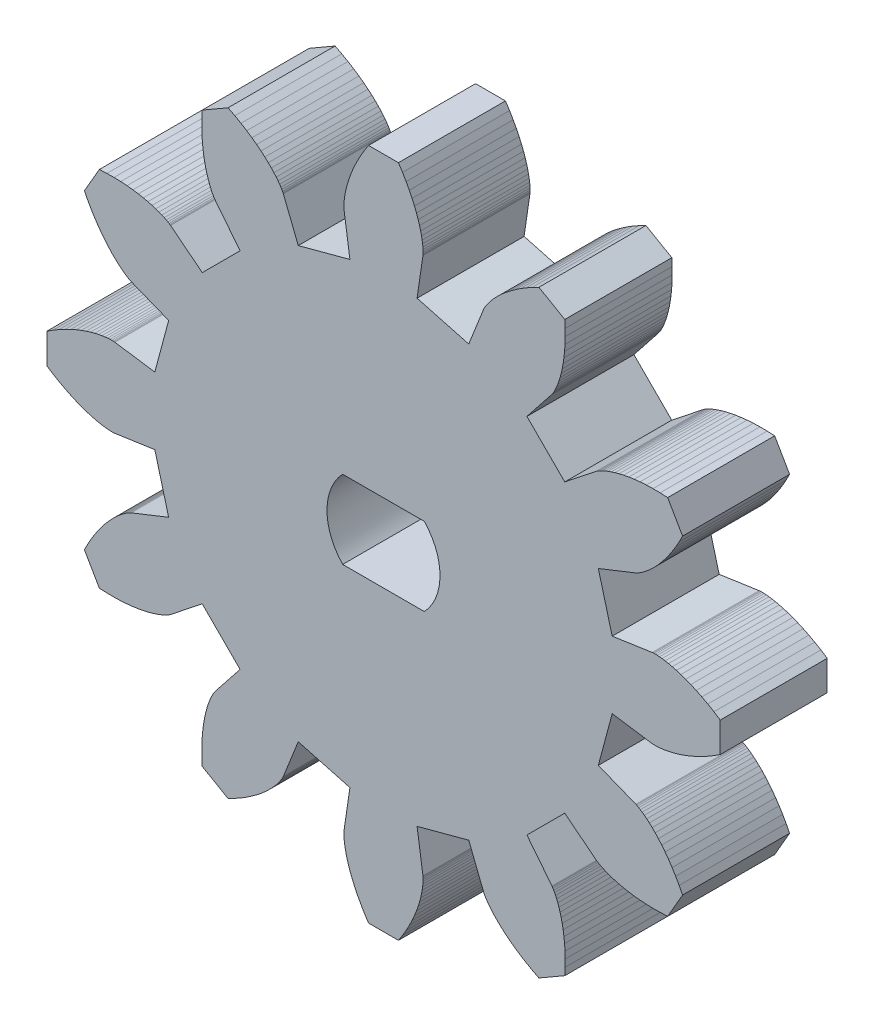
from build123d import *

# Parameters (mm, degrees)
BOSS_EXTRUDE1_DEPTH = 5
CUT_EXTRUDE1_DEPTH  = 5


with BuildPart() as part:
    # Model → Boss-Extrude1 (new body)
    with BuildSketch(Plane.XY):
        Polygon((10.685405612, 1.569110225), (12.551246005, 1.843101624), (12.5606903, 1.844240275), (12.589123441, 1.846679017), (12.636631842, 1.848946657), (12.703216397, 1.849568363), (12.788792368, 1.847070079), (12.893189492, 1.839982951), (13.016152296, 1.826847731), (13.157340631, 1.806219174), (13.316330413, 1.776670401), (13.492614581, 1.736797226), (13.685604259, 1.685222429), (13.894630123, 1.620599984), (14.118943977, 1.541619205), (14.357720528, 1.447008826), (14.610059353, 1.335540993), (14.874987068, 1.206035154), (15.151459674, 1.057361855), (15.438365097, 0.888446416), (15.734525898, 0.698272491), (15.734525898, -0.698272491), (15.438365097, -0.888446416), (15.151459674, -1.057361855), (14.874987068, -1.206035154), (14.610059353, -1.335540993), (14.357720528, -1.447008826), (14.118943977, -1.541619205), (13.894630123, -1.620599984), (13.685604259, -1.685222429), (13.492614581, -1.736797226), (13.316330413, -1.776670401), (13.157340631, -1.806219174), (13.016152296, -1.826847731), (12.893189492, -1.839982951), (12.788792368, -1.847070079), (12.703216397, -1.849568363), (12.636631842, -1.848946657), (12.589123441, -1.846679017), (12.5606903, -1.844240275), (12.551246005, -1.843101624), (10.685405612, -1.569110225), (10.038387822, -3.98381349), (11.791248702, -4.679450174), (11.799997027, -4.683186221), (11.82584022, -4.695290779), (11.868117522, -4.717081145), (11.926092291, -4.74983501), (11.998954114, -4.794786573), (12.085821112, -4.853122768), (12.185742414, -4.925979605), (12.297700819, -5.014438626), (12.420615624, -5.119523505), (12.553345604, -5.242196772), (12.694692169, -5.383356695), (12.843402654, -5.543834306), (12.998173761, -5.724390594), (13.157655131, -5.925713861), (13.320453048, -6.148417249), (13.485134259, -6.393036453), (13.65022991, -6.66002761), (13.814239575, -6.949765382), (13.975635389, -7.262541233), (13.277362898, -8.471984665), (12.925793159, -8.488599714), (12.592868055, -8.491432064), (12.279099105, -8.481950616), (11.984912054, -8.461642105), (11.710646304, -8.432006667), (11.456554556, -8.394553383), (11.222802671, -8.350795816), (11.00946974, -8.302247564), (10.816548378, -8.250417809), (10.643945222, -8.196806908), (10.491481646, -8.142902005), (10.358894683, -8.090172692), (10.245838161, -8.040066724), (10.151884035, -7.994005795), (10.076523928, -7.953381387), (10.019170864, -7.919550696), (9.979161202, -7.893832662), (9.955756751, -7.877504079), (9.948147078, -7.871795831), (8.469277598, -6.701592122), (6.701592122, -8.469277598), (7.871795831, -9.948147078), (7.877504079, -9.955756751), (7.893832662, -9.979161202), (7.919550696, -10.019170864), (7.953381387, -10.076523928), (7.994005795, -10.151884035), (8.040066724, -10.245838161), (8.090172692, -10.358894683), (8.142902005, -10.491481646), (8.196806908, -10.643945222), (8.250417809, -10.816548378), (8.302247564, -11.00946974), (8.350795816, -11.222802671), (8.394553383, -11.456554556), (8.432006667, -11.710646304), (8.461642105, -11.984912054), (8.481950616, -12.279099105), (8.491432064, -12.592868055), (8.488599714, -12.925793159), (8.471984665, -13.277362898), (7.262541233, -13.975635389), (6.949765382, -13.814239575), (6.66002761, -13.65022991), (6.393036453, -13.485134259), (6.148417249, -13.320453048), (5.925713861, -13.157655131), (5.724390594, -12.998173761), (5.543834306, -12.843402654), (5.383356695, -12.694692169), (5.242196772, -12.553345604), (5.119523505, -12.420615624), (5.014438626, -12.297700819), (4.925979605, -12.185742414), (4.853122768, -12.085821112), (4.794786573, -11.998954114), (4.74983501, -11.926092291), (4.717081145, -11.868117522), (4.695290779, -11.82584022), (4.683186221, -11.799997027), (4.679450174, -11.791248702), (3.98381349, -10.038387822), (1.569110225, -10.685405612), (1.843101624, -12.551246005), (1.844240275, -12.5606903), (1.846679017, -12.589123441), (1.848946657, -12.636631842), (1.849568363, -12.703216397), (1.847070079, -12.788792368), (1.839982951, -12.893189492), (1.826847731, -13.016152296), (1.806219174, -13.157340631), (1.776670401, -13.316330413), (1.736797226, -13.492614581), (1.685222429, -13.685604259), (1.620599984, -13.894630123), (1.541619205, -14.118943977), (1.447008826, -14.357720528), (1.335540993, -14.610059353), (1.206035154, -14.874987068), (1.057361855, -15.151459674), (0.888446416, -15.438365097), (0.698272491, -15.734525898), (-0.698272491, -15.734525898), (-0.888446416, -15.438365097), (-1.057361855, -15.151459674), (-1.206035154, -14.874987068), (-1.335540993, -14.610059353), (-1.447008826, -14.357720528), (-1.541619205, -14.118943977), (-1.620599984, -13.894630123), (-1.685222429, -13.685604259), (-1.736797226, -13.492614581), (-1.776670401, -13.316330413), (-1.806219174, -13.157340631), (-1.826847731, -13.016152296), (-1.839982951, -12.893189492), (-1.847070079, -12.788792368), (-1.849568363, -12.703216397), (-1.848946657, -12.636631842), (-1.846679017, -12.589123441), (-1.844240275, -12.5606903), (-1.843101624, -12.551246005), (-1.569110225, -10.685405612), (-3.98381349, -10.038387822), (-4.679450174, -11.791248702), (-4.683186221, -11.799997027), (-4.695290779, -11.82584022), (-4.717081145, -11.868117522), (-4.74983501, -11.926092291), (-4.794786573, -11.998954114), (-4.853122768, -12.085821112), (-4.925979605, -12.185742414), (-5.014438626, -12.297700819), (-5.119523505, -12.420615624), (-5.242196772, -12.553345604), (-5.383356695, -12.694692169), (-5.543834306, -12.843402654), (-5.724390594, -12.998173761), (-5.925713861, -13.157655131), (-6.148417249, -13.320453048), (-6.393036453, -13.485134259), (-6.66002761, -13.65022991), (-6.949765382, -13.814239575), (-7.262541233, -13.975635389), (-8.471984665, -13.277362898), (-8.488599714, -12.925793159), (-8.491432064, -12.592868055), (-8.481950616, -12.279099105), (-8.461642105, -11.984912054), (-8.432006667, -11.710646304), (-8.394553383, -11.456554556), (-8.350795816, -11.222802671), (-8.302247564, -11.00946974), (-8.250417809, -10.816548378), (-8.196806908, -10.643945222), (-8.142902005, -10.491481646), (-8.090172692, -10.358894683), (-8.040066724, -10.245838161), (-7.994005795, -10.151884035), (-7.953381387, -10.076523928), (-7.919550696, -10.019170864), (-7.893832662, -9.979161202), (-7.877504079, -9.955756751), (-7.871795831, -9.948147078), (-6.701592122, -8.469277598), (-8.469277598, -6.701592122), (-9.948147078, -7.871795831), (-9.955756751, -7.877504079), (-9.979161202, -7.893832662), (-10.019170864, -7.919550696), (-10.076523928, -7.953381387), (-10.151884035, -7.994005795), (-10.245838161, -8.040066724), (-10.358894683, -8.090172692), (-10.491481646, -8.142902005), (-10.643945222, -8.196806908), (-10.816548378, -8.250417809), (-11.00946974, -8.302247564), (-11.222802671, -8.350795816), (-11.456554556, -8.394553383), (-11.710646304, -8.432006667), (-11.984912054, -8.461642105), (-12.279099105, -8.481950616), (-12.592868055, -8.491432064), (-12.925793159, -8.488599714), (-13.277362898, -8.471984665), (-13.975635389, -7.262541233), (-13.814239575, -6.949765382), (-13.65022991, -6.66002761), (-13.485134259, -6.393036453), (-13.320453048, -6.148417249), (-13.157655131, -5.925713861), (-12.998173761, -5.724390594), (-12.843402654, -5.543834306), (-12.694692169, -5.383356695), (-12.553345604, -5.242196772), (-12.420615624, -5.119523505), (-12.297700819, -5.014438626), (-12.185742414, -4.925979605), (-12.085821112, -4.853122768), (-11.998954114, -4.794786573), (-11.926092291, -4.74983501), (-11.868117522, -4.717081145), (-11.82584022, -4.695290779), (-11.799997027, -4.683186221), (-11.791248702, -4.679450174), (-10.038387822, -3.98381349), (-10.685405612, -1.569110225), (-12.551246005, -1.843101624), (-12.5606903, -1.844240275), (-12.589123441, -1.846679017), (-12.636631842, -1.848946657), (-12.703216397, -1.849568363), (-12.788792368, -1.847070079), (-12.893189492, -1.839982951), (-13.016152296, -1.826847731), (-13.157340631, -1.806219174), (-13.316330413, -1.776670401), (-13.492614581, -1.736797226), (-13.685604259, -1.685222429), (-13.894630123, -1.620599984), (-14.118943977, -1.541619205), (-14.357720528, -1.447008826), (-14.610059353, -1.335540993), (-14.874987068, -1.206035154), (-15.151459674, -1.057361855), (-15.438365097, -0.888446416), (-15.734525898, -0.698272491), (-15.734525898, 0.698272491), (-15.438365097, 0.888446416), (-15.151459674, 1.057361855), (-14.874987068, 1.206035154), (-14.610059353, 1.335540993), (-14.357720528, 1.447008826), (-14.118943977, 1.541619205), (-13.894630123, 1.620599984), (-13.685604259, 1.685222429), (-13.492614581, 1.736797226), (-13.316330413, 1.776670401), (-13.157340631, 1.806219174), (-13.016152296, 1.826847731), (-12.893189492, 1.839982951), (-12.788792368, 1.847070079), (-12.703216397, 1.849568363), (-12.636631842, 1.848946657), (-12.589123441, 1.846679017), (-12.5606903, 1.844240275), (-12.551246005, 1.843101624), (-10.685405612, 1.569110225), (-10.038387822, 3.98381349), (-11.791248702, 4.679450174), (-11.799997027, 4.683186221), (-11.82584022, 4.695290779), (-11.868117522, 4.717081145), (-11.926092291, 4.74983501), (-11.998954114, 4.794786573), (-12.085821112, 4.853122768), (-12.185742414, 4.925979605), (-12.297700819, 5.014438626), (-12.420615624, 5.119523505), (-12.553345604, 5.242196772), (-12.694692169, 5.383356695), (-12.843402654, 5.543834306), (-12.998173761, 5.724390594), (-13.157655131, 5.925713861), (-13.320453048, 6.148417249), (-13.485134259, 6.393036453), (-13.65022991, 6.66002761), (-13.814239575, 6.949765382), (-13.975635389, 7.262541233), (-13.277362898, 8.471984665), (-12.925793159, 8.488599714), (-12.592868055, 8.491432064), (-12.279099105, 8.481950616), (-11.984912054, 8.461642105), (-11.710646304, 8.432006667), (-11.456554556, 8.394553383), (-11.222802671, 8.350795816), (-11.00946974, 8.302247564), (-10.816548378, 8.250417809), (-10.643945222, 8.196806908), (-10.491481646, 8.142902005), (-10.358894683, 8.090172692), (-10.245838161, 8.040066724), (-10.151884035, 7.994005795), (-10.076523928, 7.953381387), (-10.019170864, 7.919550696), (-9.979161202, 7.893832662), (-9.955756751, 7.877504079), (-9.948147078, 7.871795831), (-8.469277598, 6.701592122), (-6.701592122, 8.469277598), (-7.871795831, 9.948147078), (-7.877504079, 9.955756751), (-7.893832662, 9.979161202), (-7.919550696, 10.019170864), (-7.953381387, 10.076523928), (-7.994005795, 10.151884035), (-8.040066724, 10.245838161), (-8.090172692, 10.358894683), (-8.142902005, 10.491481646), (-8.196806908, 10.643945222), (-8.250417809, 10.816548378), (-8.302247564, 11.00946974), (-8.350795816, 11.222802671), (-8.394553383, 11.456554556), (-8.432006667, 11.710646304), (-8.461642105, 11.984912054), (-8.481950616, 12.279099105), (-8.491432064, 12.592868055), (-8.488599714, 12.925793159), (-8.471984665, 13.277362898), (-7.262541233, 13.975635389), (-6.949765382, 13.814239575), (-6.66002761, 13.65022991), (-6.393036453, 13.485134259), (-6.148417249, 13.320453048), (-5.925713861, 13.157655131), (-5.724390594, 12.998173761), (-5.543834306, 12.843402654), (-5.383356695, 12.694692169), (-5.242196772, 12.553345604), (-5.119523505, 12.420615624), (-5.014438626, 12.297700819), (-4.925979605, 12.185742414), (-4.853122768, 12.085821112), (-4.794786573, 11.998954114), (-4.74983501, 11.926092291), (-4.717081145, 11.868117522), (-4.695290779, 11.82584022), (-4.683186221, 11.799997027), (-4.679450174, 11.791248702), (-3.98381349, 10.038387822), (-1.569110225, 10.685405612), (-1.843101624, 12.551246005), (-1.844240275, 12.5606903), (-1.846679017, 12.589123441), (-1.848946657, 12.636631842), (-1.849568363, 12.703216397), (-1.847070079, 12.788792368), (-1.839982951, 12.893189492), (-1.826847731, 13.016152296), (-1.806219174, 13.157340631), (-1.776670401, 13.316330413), (-1.736797226, 13.492614581), (-1.685222429, 13.685604259), (-1.620599984, 13.894630123), (-1.541619205, 14.118943977), (-1.447008826, 14.357720528), (-1.335540993, 14.610059353), (-1.206035154, 14.874987068), (-1.057361855, 15.151459674), (-0.888446416, 15.438365097), (-0.698272491, 15.734525898), (0.698272491, 15.734525898), (0.888446416, 15.438365097), (1.057361855, 15.151459674), (1.206035154, 14.874987068), (1.335540993, 14.610059353), (1.447008826, 14.357720528), (1.541619205, 14.118943977), (1.620599984, 13.894630123), (1.685222429, 13.685604259), (1.736797226, 13.492614581), (1.776670401, 13.316330413), (1.806219174, 13.157340631), (1.826847731, 13.016152296), (1.839982951, 12.893189492), (1.847070079, 12.788792368), (1.849568363, 12.703216397), (1.848946657, 12.636631842), (1.846679017, 12.589123441), (1.844240275, 12.5606903), (1.843101624, 12.551246005), (1.569110225, 10.685405612), (3.98381349, 10.038387822), (4.679450174, 11.791248702), (4.683186221, 11.799997027), (4.695290779, 11.82584022), (4.717081145, 11.868117522), (4.74983501, 11.926092291), (4.794786573, 11.998954114), (4.853122768, 12.085821112), (4.925979605, 12.185742414), (5.014438626, 12.297700819), (5.119523505, 12.420615624), (5.242196772, 12.553345604), (5.383356695, 12.694692169), (5.543834306, 12.843402654), (5.724390594, 12.998173761), (5.925713861, 13.157655131), (6.148417249, 13.320453048), (6.393036453, 13.485134259), (6.66002761, 13.65022991), (6.949765382, 13.814239575), (7.262541233, 13.975635389), (8.471984665, 13.277362898), (8.488599714, 12.925793159), (8.491432064, 12.592868055), (8.481950616, 12.279099105), (8.461642105, 11.984912054), (8.432006667, 11.710646304), (8.394553383, 11.456554556), (8.350795816, 11.222802671), (8.302247564, 11.00946974), (8.250417809, 10.816548378), (8.196806908, 10.643945222), (8.142902005, 10.491481646), (8.090172692, 10.358894683), (8.040066724, 10.245838161), (7.994005795, 10.151884035), (7.953381387, 10.076523928), (7.919550696, 10.019170864), (7.893832662, 9.979161202), (7.877504079, 9.955756751), (7.871795831, 9.948147078), (6.701592122, 8.469277598), (8.469277598, 6.701592122), (9.948147078, 7.871795831), (9.955756751, 7.877504079), (9.979161202, 7.893832662), (10.019170864, 7.919550696), (10.076523928, 7.953381387), (10.151884035, 7.994005795), (10.245838161, 8.040066724), (10.358894683, 8.090172692), (10.491481646, 8.142902005), (10.643945222, 8.196806908), (10.816548378, 8.250417809), (11.00946974, 8.302247564), (11.222802671, 8.350795816), (11.456554556, 8.394553383), (11.710646304, 8.432006667), (11.984912054, 8.461642105), (12.279099105, 8.481950616), (12.592868055, 8.491432064), (12.925793159, 8.488599714), (13.277362898, 8.471984665), (13.975635389, 7.262541233), (13.814239575, 6.949765382), (13.65022991, 6.66002761), (13.485134259, 6.393036453), (13.320453048, 6.148417249), (13.157655131, 5.925713861), (12.998173761, 5.724390594), (12.843402654, 5.543834306), (12.694692169, 5.383356695), (12.553345604, 5.242196772), (12.420615624, 5.119523505), (12.297700819, 5.014438626), (12.185742414, 4.925979605), (12.085821112, 4.853122768), (11.998954114, 4.794786573), (11.926092291, 4.74983501), (11.868117522, 4.717081145), (11.82584022, 4.695290779), (11.799997027, 4.683186221), (11.791248702, 4.679450174), (10.038387822, 3.98381349), align=None)
    extrude(amount=BOSS_EXTRUDE1_DEPTH)

    # Sketch3 → Cut-Extrude1 (cut)
    with BuildSketch(Plane.XY.offset(5)):
        with BuildLine():
            Line((1.907609761, 1.825), (-1.907609761, 1.825))
            ThreePointArc((-1.907609761, 1.825), (-2.64, 0), (-1.907609761, -1.825))
            Line((-1.907609761, -1.825), (1.907609761, -1.825))
            ThreePointArc((1.907609761, -1.825), (2.64, 0), (1.907609761, 1.825))
        make_face()
    extrude(amount=-CUT_EXTRUDE1_DEPTH, mode=Mode.SUBTRACT)


solid = part.part
